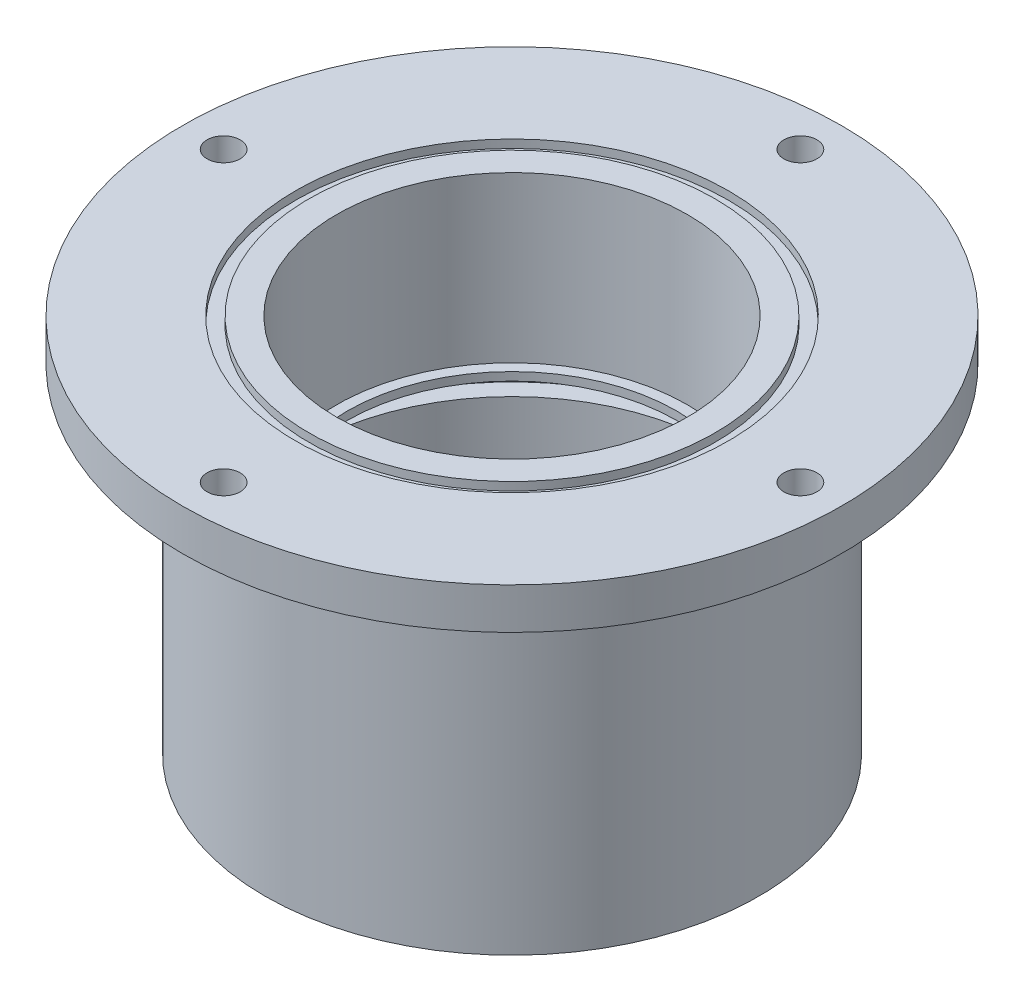
from build123d import *

# Parameters (mm, degrees)
TAPPED_HOLE_FOR_10_32_HELICOIL1_D = 5.1054
CIRPATTERN1_COUNT                 = 4


with BuildPart() as part:
    # Sketch1 → Revolve1 (revolve)
    with BuildSketch(Plane.XY, mode=Mode.PRIVATE) as revolve1_sk:
        Polygon((31.8135, 0), (38.1, 0), (38.1, 52.07), (50.8, 52.07), (50.8, 58.42), (33.3883, 58.42), (33.3883, 57.15), (31.2801, 57.15), (31.2801, 58.42), (27.051, 58.42), (27.051, 33.02), (25.4, 33.02), (25.4, 31.75), (31.8135, 31.75), (31.8135, 28.702), (34.582975987, 28.702), (34.582975987, 25.146), (31.8135, 25.146), (31.8135, 6.096), (33.909, 6.096), (33.909, 2.54), (31.8135, 2.54), align=None)
    revolve(revolve1_sk.sketch.rotate(Axis((0, 0, 0), (0, 1, 0)), 90), axis=Axis((0, 0, 0), (0, 1, 0)))

    # Tapped Hole for #10-32 Helicoil1 (through all)
    with Locations(Plane(origin=(0, 58.42, 0), x_dir=(1, 0, 0), z_dir=(0, 1, 0))):
        with Locations((0, 44.45)):
            tapped_hole_for_10_32_helicoil1 = Hole(TAPPED_HOLE_FOR_10_32_HELICOIL1_D / 2)

    # CirPattern1: Tapped Hole for #10-32 Helicoil1 ×4 about axis
    cirpattern1_axis = Axis((0, 0, 0), (0, 1, 0))
    for i in range(1, CIRPATTERN1_COUNT):
        add(tapped_hole_for_10_32_helicoil1.rotate(cirpattern1_axis, i * 360 / CIRPATTERN1_COUNT), mode=Mode.SUBTRACT)


solid = part.part
